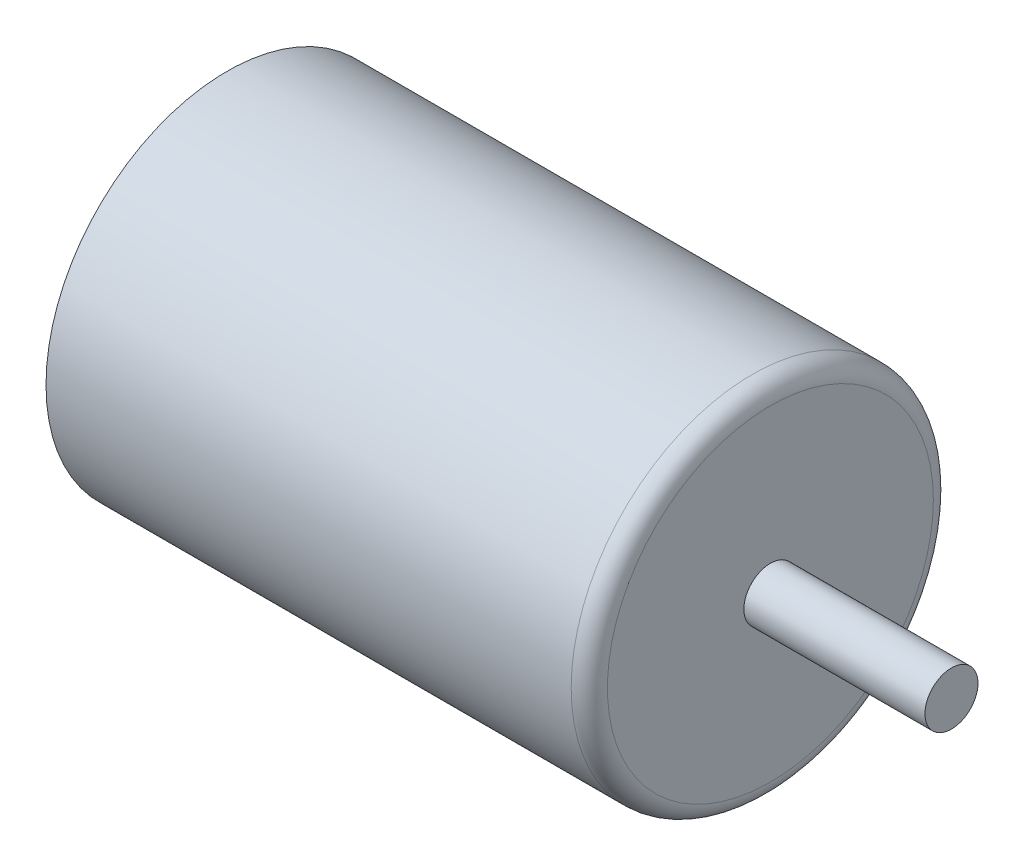
from build123d import *

# Parameters (mm, degrees)
SKETCH1_R           = 25.4
BOSS_EXTRUDE1_DEPTH = 76.2
SKETCH2_R           = 3.720516443
BOSS_EXTRUDE2_DEPTH = 25.4
FILLET1_R           = 2.54


with BuildPart() as part:
    # Sketch1 → Boss-Extrude1 (new body)
    with BuildSketch(Plane(origin=(0, 0, 0), x_dir=(0, 0, -1), z_dir=(1, 0, 0))):
        with Locations(Location((0, 0, 0), (0, 0, 180))):
            Circle(SKETCH1_R)
    extrude(amount=BOSS_EXTRUDE1_DEPTH)

    # Sketch2 → Boss-Extrude2 (add)
    with BuildSketch(Plane(origin=(76.2, 0, 0), x_dir=(0, 0, -1), z_dir=(1, 0, 0))):
        Circle(SKETCH2_R)
    extrude(amount=BOSS_EXTRUDE2_DEPTH)

    # Fillet1
    fillet1_edges = [part.edges().sort_by_distance(p)[0] for p in [
        (76.2, 0, -25.4),
    ]]
    fillet(fillet1_edges, radius=FILLET1_R)


solid = part.part
